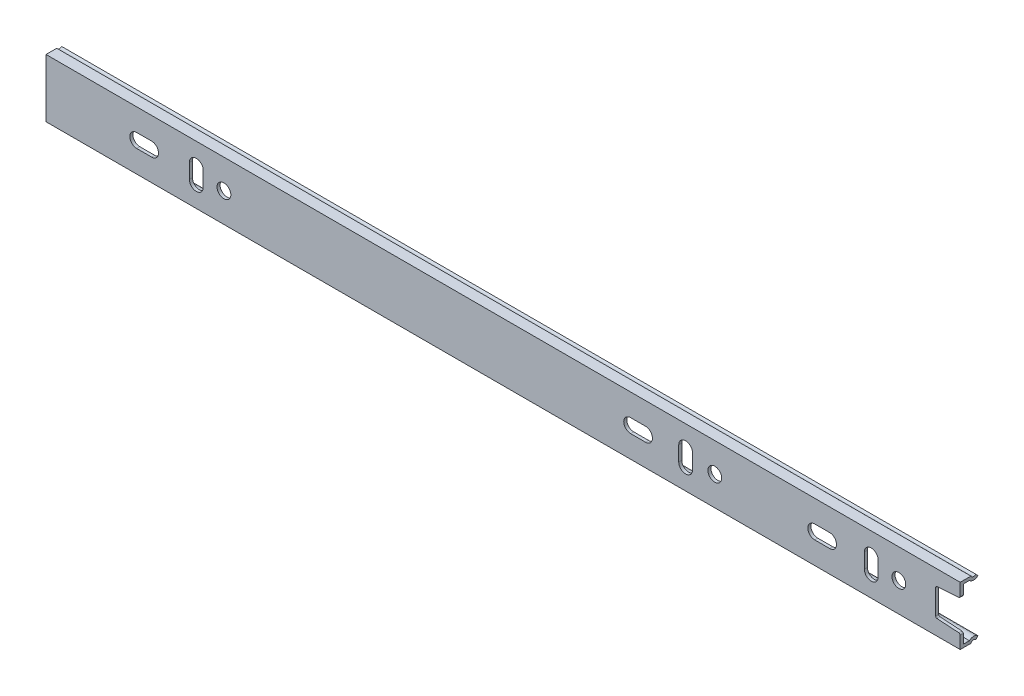
from build123d import *

# Parameters (mm, degrees)
EXTRUDE_THIN1_DEPTH   = 298
ESBO_O1_R             = 2.25
CORTE_EXTRUS_O1_DEPTH = 299.207817733
FILETE1_R             = 0.5


with BuildPart() as part:
    # Sketch1 → Extrude-Thin1 (new body)
    with BuildSketch(Plane(origin=(0, 0, 0), x_dir=(0, 0, -1), z_dir=(1, 0, 0))):
        with BuildLine():
            ThreePointArc((-7.953264718, 8.5), (-9.353805922, 7.927754998), (-10.754347127, 8.5))
            Line((-10.754347127, 8.5), (-12.754347127, 8.5))
            Line((-12.754347127, 8.5), (-12.754347127, -8.5))
            Line((-12.754347127, -8.5), (-10.754347127, -8.5))
            ThreePointArc((-10.754347127, -8.5), (-9.353805922, -7.927754998), (-7.953264718, -8.5))
            Line((-7.953264718, -8.5), (-8.65353532, -9.213877499))
            ThreePointArc((-8.65353532, -9.213877499), (-9.529396971, -8.943291803), (-10.25770064, -9.5))
            Line((-10.25770064, -9.5), (-13.754347127, -9.5))
            Line((-13.754347127, -9.5), (-13.754347127, 9.5))
            Line((-13.754347127, 9.5), (-10.25770064, 9.5))
            ThreePointArc((-10.25770064, 9.5), (-9.529396971, 8.943291803), (-8.65353532, 9.213877499))
            Line((-8.65353532, 9.213877499), (-7.953264718, 8.5))
        make_face()
    extrude(amount=-EXTRUDE_THIN1_DEPTH)

    # Esboço1 → Corte-extrusão1 (cut, through all)
    with BuildSketch(Plane.XY.offset(13.754347127)):
        with Locations((-240, 0)):
            Circle(ESBO_O1_R)
        with Locations((-20, 0)):
            Circle(ESBO_O1_R)
        with Locations((-80, 0)):
            Circle(ESBO_O1_R)
        with BuildLine():
            Line((-268.425, 2.25), (-263.575, 2.25))
            ThreePointArc((-263.575, 2.25), (-261.325, 0), (-263.575, -2.25))
            Line((-263.575, -2.25), (-268.425, -2.25))
            ThreePointArc((-268.425, -2.25), (-270.675, 0), (-268.425, 2.25))
        make_face()
        with BuildLine():
            Line((-246.75, 2.425), (-246.75, -2.425))
            ThreePointArc((-246.75, -2.425), (-249, -4.675), (-251.25, -2.425))
            Line((-251.25, -2.425), (-251.25, 2.425))
            ThreePointArc((-251.25, 2.425), (-249, 4.675), (-246.75, 2.425))
        make_face()
        Polygon((-8, 4.5), (-8, -4.5), (0, -5), (0, 5), align=None)
        with BuildLine():
            Line((-47.425, 2.25), (-42.575, 2.25))
            ThreePointArc((-42.575, 2.25), (-40.325, 0), (-42.575, -2.25))
            Line((-42.575, -2.25), (-47.425, -2.25))
            ThreePointArc((-47.425, -2.25), (-49.675, 0), (-47.425, 2.25))
        make_face()
        with BuildLine():
            Line((-26.75, 2.425), (-26.75, -2.425))
            ThreePointArc((-26.75, -2.425), (-29, -4.675), (-31.25, -2.425))
            Line((-31.25, -2.425), (-31.25, 2.425))
            ThreePointArc((-31.25, 2.425), (-29, 4.675), (-26.75, 2.425))
        make_face()
        with BuildLine():
            Line((-107.425, 2.25), (-102.575, 2.25))
            ThreePointArc((-102.575, 2.25), (-100.325, 0), (-102.575, -2.25))
            Line((-102.575, -2.25), (-107.425, -2.25))
            ThreePointArc((-107.425, -2.25), (-109.675, 0), (-107.425, 2.25))
        make_face()
        with BuildLine():
            Line((-87.25, 2.425), (-87.25, -2.425))
            ThreePointArc((-87.25, -2.425), (-89.5, -4.675), (-91.75, -2.425))
            Line((-91.75, -2.425), (-91.75, 2.425))
            ThreePointArc((-91.75, 2.425), (-89.5, 4.675), (-87.25, 2.425))
        make_face()
    extrude(amount=-CORTE_EXTRUS_O1_DEPTH, mode=Mode.SUBTRACT)

    # Filete1
    filete1_edges = [part.edges().sort_by_distance(p)[0] for p in [
        (-8, -4.5, 13.254347127),
        (-8, 4.5, 13.254347127),
        (0, 5, 13.254347127),
        (0, -5, 13.254347127),
    ]]
    fillet(filete1_edges, radius=FILETE1_R)


solid = part.part
